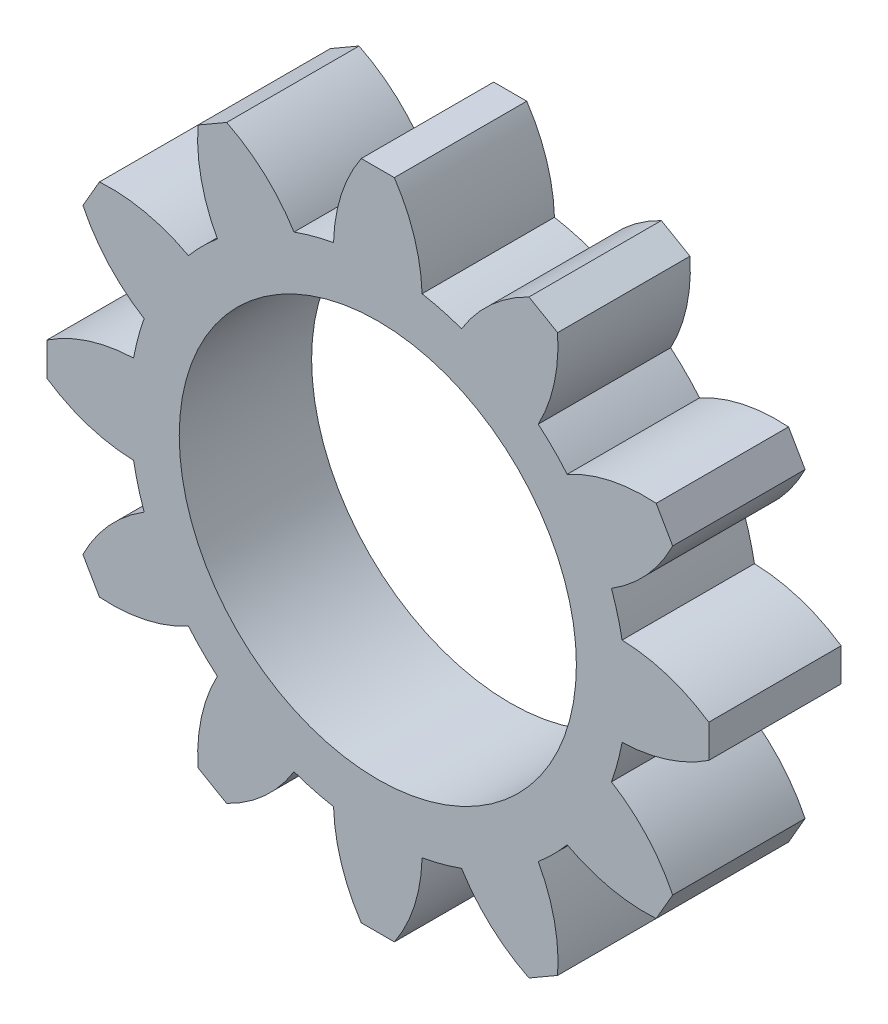
from build123d import *

# Parameters (mm, degrees)
SKETCH1_R           = 12
BOSS_EXTRUDE1_DEPTH = 8


with BuildPart() as part:
    # Sketch1 → Boss-Extrude1 (new body)
    with BuildSketch(Plane(origin=(0, 0, 0), x_dir=(0, 1, 0), z_dir=(0, 0, 1))):
        with BuildLine():
            Line((20, 1), (20, -1))
            ThreePointArc((20, -1), (17.497232023, -2.204975942), (14.759551992, -2.675))
            ThreePointArc((14.759551992, -2.675), (14.488887394, -3.882285677), (14.119646973, -5.063158041))
            ThreePointArc((14.119646973, -5.063158041), (16.262701001, -6.832536438), (17.820508076, -9.133974596))
            Line((17.820508076, -9.133974596), (16.820508076, -10.866025404))
            ThreePointArc((16.820508076, -10.866025404), (14.050559457, -10.658181192), (11.444646973, -9.696393951))
            ThreePointArc((11.444646973, -9.696393951), (10.606601718, -10.606601718), (9.696393951, -11.444646973))
            ThreePointArc((9.696393951, -11.444646973), (10.667643983, -14.048500628), (10.866025404, -16.820508076))
            Line((10.866025404, -16.820508076), (9.133974596, -17.820508076))
            ThreePointArc((9.133974596, -17.820508076), (6.839050831, -16.255535399), (5.063158041, -14.119646973))
            ThreePointArc((5.063158041, -14.119646973), (3.882285677, -14.488887394), (2.675, -14.759551992))
            ThreePointArc((2.675, -14.759551992), (2.214200373, -17.50018042), (1, -20))
            Line((1, -20), (-1, -20))
            ThreePointArc((-1, -20), (-2.204975942, -17.497232023), (-2.675, -14.759551992))
            ThreePointArc((-2.675, -14.759551992), (-3.882285677, -14.488887394), (-5.063158041, -14.119646973))
            ThreePointArc((-5.063158041, -14.119646973), (-6.832536438, -16.262701001), (-9.133974596, -17.820508076))
            Line((-9.133974596, -17.820508076), (-10.866025404, -16.820508076))
            ThreePointArc((-10.866025404, -16.820508076), (-10.658181192, -14.050559457), (-9.696393951, -11.444646973))
            ThreePointArc((-9.696393951, -11.444646973), (-10.606601718, -10.606601718), (-11.444646973, -9.696393951))
            ThreePointArc((-11.444646973, -9.696393951), (-14.048500628, -10.667643983), (-16.820508076, -10.866025404))
            Line((-16.820508076, -10.866025404), (-17.820508076, -9.133974596))
            ThreePointArc((-17.820508076, -9.133974596), (-16.255535399, -6.839050831), (-14.119646973, -5.063158041))
            ThreePointArc((-14.119646973, -5.063158041), (-14.488887394, -3.882285677), (-14.759551992, -2.675))
            ThreePointArc((-14.759551992, -2.675), (-17.50018042, -2.214200373), (-20, -1))
            Line((-20, -1), (-20, 1))
            ThreePointArc((-20, 1), (-17.497232023, 2.204975942), (-14.759551992, 2.675))
            ThreePointArc((-14.759551992, 2.675), (-14.488887394, 3.882285677), (-14.119646973, 5.063158041))
            ThreePointArc((-14.119646973, 5.063158041), (-16.262701001, 6.832536438), (-17.820508076, 9.133974596))
            Line((-17.820508076, 9.133974596), (-16.820508076, 10.866025404))
            ThreePointArc((-16.820508076, 10.866025404), (-14.050559457, 10.658181192), (-11.444646973, 9.696393951))
            ThreePointArc((-11.444646973, 9.696393951), (-10.606601718, 10.606601718), (-9.696393951, 11.444646973))
            ThreePointArc((-9.696393951, 11.444646973), (-10.667643983, 14.048500628), (-10.866025404, 16.820508076))
            Line((-10.866025404, 16.820508076), (-9.133974596, 17.820508076))
            ThreePointArc((-9.133974596, 17.820508076), (-6.839050831, 16.255535399), (-5.063158041, 14.119646973))
            ThreePointArc((-5.063158041, 14.119646973), (-3.882285677, 14.488887394), (-2.675, 14.759551992))
            ThreePointArc((-2.675, 14.759551992), (-2.214200373, 17.50018042), (-1, 20))
            Line((-1, 20), (1, 20))
            ThreePointArc((1, 20), (2.204975942, 17.497232023), (2.675, 14.759551992))
            ThreePointArc((2.675, 14.759551992), (3.882285677, 14.488887394), (5.063158041, 14.119646973))
            ThreePointArc((5.063158041, 14.119646973), (6.832536438, 16.262701001), (9.133974596, 17.820508076))
            Line((9.133974596, 17.820508076), (10.866025404, 16.820508076))
            ThreePointArc((10.866025404, 16.820508076), (10.658181192, 14.050559457), (9.696393951, 11.444646973))
            ThreePointArc((9.696393951, 11.444646973), (10.606601718, 10.606601718), (11.444646973, 9.696393951))
            ThreePointArc((11.444646973, 9.696393951), (14.048500628, 10.667643983), (16.820508076, 10.866025404))
            Line((16.820508076, 10.866025404), (17.820508076, 9.133974596))
            ThreePointArc((17.820508076, 9.133974596), (16.255535399, 6.839050831), (14.119646973, 5.063158041))
            ThreePointArc((14.119646973, 5.063158041), (14.488887394, 3.882285677), (14.759551992, 2.675))
            ThreePointArc((14.759551992, 2.675), (17.50018042, 2.214200373), (20, 1))
        make_face()
        with Locations(Location((0, 0, 0), (0, 0, 270))):
            Circle(SKETCH1_R, mode=Mode.SUBTRACT)
    extrude(amount=BOSS_EXTRUDE1_DEPTH)


solid = part.part
